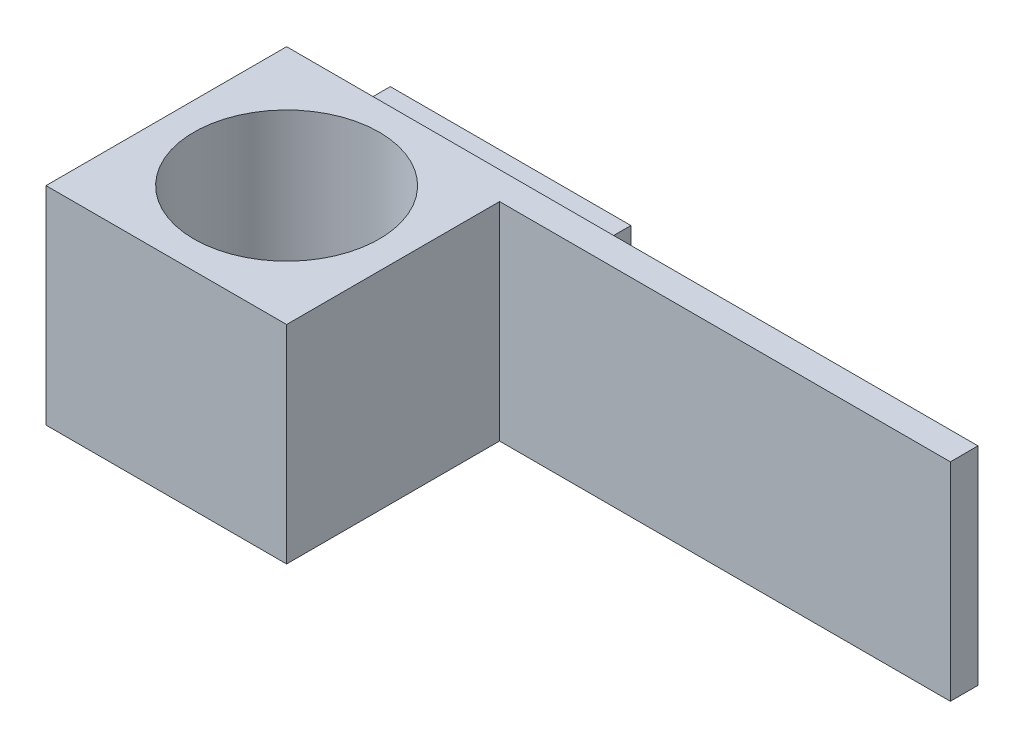
from build123d import *

# Parameters (mm, degrees)
SKETCH1_R           = 13.4
BOSS_EXTRUDE1_DEPTH = 30
BOSS_EXTRUDE2_DEPTH = 34.8


with BuildPart() as part:
    # Sketch1 → Boss-Extrude1 (new body)
    with BuildSketch(Plane(origin=(0, 0, 0), x_dir=(1, 0, 0), z_dir=(0, 1, 0))):
        Polygon((-17.4, 17.4), (17.4, 17.4), (82.6, 17.4), (82.6, 13.4), (17.4, 13.4), (17.4, -17.4), (-17.4, -17.4), align=None)
        with Locations(Location((0, 0, 0), (0, 0, 270))):
            Circle(SKETCH1_R, mode=Mode.SUBTRACT)
    extrude(amount=BOSS_EXTRUDE1_DEPTH)

    # Sketch3 → Boss-Extrude2 (add)
    with BuildSketch(Plane.ZY.offset(17.4)):
        with BuildLine():
            Line((-17.4, 0), (-32.4, 0))
            Line((-32.4, 0), (-32.4, 3))
            ThreePointArc((-32.4, 3), (-27.598787547, 3.605237022), (-24.805858924, 7.557135626))
            Line((-24.805858924, 7.557135626), (-17.4, 7.557135626))
            Line((-17.4, 7.557135626), (-17.4, 0))
        make_face()
        with BuildLine():
            Line((-32.4, 14.5), (-32.4, 17.5))
            Line((-32.4, 17.5), (-17.4, 17.5))
            Line((-17.4, 17.5), (-17.4, 10.557135626))
            Line((-17.4, 10.557135626), (-24.964700082, 10.557135626))
            ThreePointArc((-24.964700082, 10.557135626), (-27.875124937, 14.050801443), (-32.4, 14.5))
        make_face()
    extrude(amount=-BOSS_EXTRUDE2_DEPTH)


solid = part.part
